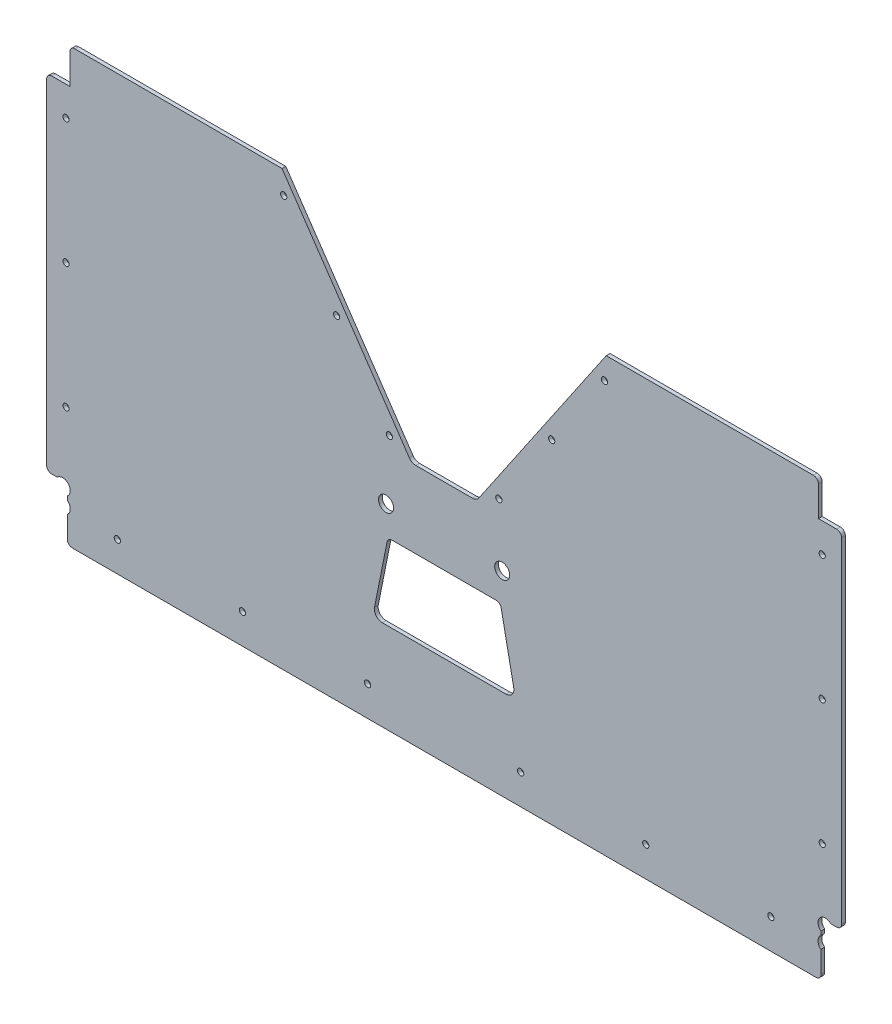
from build123d import *

# Parameters (mm, degrees)
SKETCH_1_R          = 6
EXTRUDE_1_DEPTH     = 3
SKETCH_2_R          = 2.5
SKETCH_2_W          = 12
SKETCH_2_H          = 28
SKETCH_2_W_2        = 10
CUT_EXTRUDE_1_DEPTH = 725.098439741
SKETCH_3_W          = 6.5
SKETCH_3_H          = 275.47
EXTRUDE_2_DEPTH     = 3
SKETCH_4_W          = 602.3
SKETCH_4_H          = 15
EXTRUDE_3_DEPTH     = 3
FILLET_1_R          = 4


with BuildPart() as part:
    # 草图1 → 凸台-拉伸1 (new body)
    with BuildSketch(Plane.XY):
        with BuildLine():
            Line((64.592959067, -287.27493325), (-37.121356584, -436.580350718))
            ThreePointArc((-37.121356584, -436.580350718), (-39.401099826, -438.618784839), (-42.369287668, -439.355197667))
            Line((-42.369287668, -439.355197667), (-87.565404468, -439.355197667))
            ThreePointArc((-87.565404468, -439.355197667), (-90.533592309, -438.618784839), (-92.813335552, -436.580350718))
            Line((-92.813335552, -436.580350718), (-194.527651202, -287.27493325))
            Line((-194.527651202, -287.27493325), (-376.117346068, -287.27493325))
            Line((-376.117346068, -287.27493325), (-376.117346068, -612.39493325))
            ThreePointArc((-376.117346068, -612.39493325), (-374.257474128, -616.885061311), (-369.767346068, -618.74493325))
            Line((-369.767346068, -618.74493325), (239.832653932, -618.74493325))
            ThreePointArc((239.832653932, -618.74493325), (244.322781993, -616.885061311), (246.182653932, -612.39493325))
            Line((246.182653932, -612.39493325), (246.182653932, -287.27493325))
            Line((246.182653932, -287.27493325), (64.592959067, -287.27493325))
        make_face()
        with Locations((-111.371152168, -477.768197584)):
            Circle(SKETCH_1_R, mode=Mode.SUBTRACT)
        with Locations((-18.563539968, -477.768197584)):
            Circle(SKETCH_1_R, mode=Mode.SUBTRACT)
        with Locations((239.832653932, -607.63243325)):
            Circle(SKETCH_1_R, mode=Mode.SUBTRACT)
        with Locations((239.832653932, -594.93243325)):
            Circle(SKETCH_1_R, mode=Mode.SUBTRACT)
        with Locations(Location((-369.767346068, -607.63243325, 0), (0, 0, 180))):
            Circle(SKETCH_1_R, mode=Mode.SUBTRACT)
        with Locations(Location((-369.767346068, -594.93243325, 0), (0, 0, 180))):
            Circle(SKETCH_1_R, mode=Mode.SUBTRACT)
        with BuildLine():
            Line((-120.598278576, -553.999595792), (-117.888346515, -540.449935487))
            Line((-117.888346515, -540.449935487), (-113.593422095, -518.975313388))
            Line((-113.593422095, -518.975313388), (-109.909811627, -500.557261048))
            ThreePointArc((-109.909811627, -500.557261048), (-109.015545442, -498.354731753), (-107.373986867, -496.635390964))
            Line((-107.373986867, -496.635390964), (-68.658208598, -468.981263629))
            ThreePointArc((-68.658208598, -468.981263629), (-64.967346068, -467.798471171), (-61.276483538, -468.981263629))
            Line((-61.276483538, -468.981263629), (-22.560705269, -496.635390964))
            ThreePointArc((-22.560705269, -496.635390964), (-20.919146693, -498.354731753), (-20.024880508, -500.557261048))
            Line((-20.024880508, -500.557261048), (-16.34127004, -518.975313388))
            Line((-16.34127004, -518.975313388), (-12.04634562, -540.449935487))
            Line((-12.04634562, -540.449935487), (-9.336413559, -553.999595792))
            ThreePointArc((-9.336413559, -553.999595792), (-10.652378252, -559.270762801), (-15.56310085, -561.59493325))
            Line((-15.56310085, -561.59493325), (-114.371591285, -561.59493325))
            ThreePointArc((-114.371591285, -561.59493325), (-119.282313883, -559.270762801), (-120.598278576, -553.999595792))
        make_face(mode=Mode.SUBTRACT)
    extrude(amount=EXTRUDE_1_DEPTH)

    # 草图2 → 切除-拉伸1 (cut, through all)
    with BuildSketch(Plane.XY.offset(3)):
        with Locations((-193.155157013, -305.27493325)):
            Circle(SKETCH_2_R)
        with Locations((-108.702722738, -429.24180925)):
            Circle(SKETCH_2_R)
        with Locations((-150.928939875, -367.25837125)):
            Circle(SKETCH_2_R)
        with Locations((-326.117346068, -609.74493325)):
            Circle(SKETCH_2_R)
        with Locations((-367.117346068, -338.74493325)):
            Circle(SKETCH_2_R)
        with Locations((-367.117346068, -538.74493325)):
            Circle(SKETCH_2_R)
        with Locations((-367.117346068, -438.74493325)):
            Circle(SKETCH_2_R)
        with Locations((-126.117346068, -609.74493325)):
            Circle(SKETCH_2_R)
        with Locations((-226.117346068, -609.74493325)):
            Circle(SKETCH_2_R)
        with Locations(Location((-21.231969397, -429.24180925, 0), (0, 0, 180))):
            Circle(SKETCH_2_R)
        with Locations(Location((20.99424774, -367.25837125, 0), (0, 0, 180))):
            Circle(SKETCH_2_R)
        with Locations(Location((63.220464877, -305.27493325, 0), (0, 0, 180))):
            Circle(SKETCH_2_R)
        with Locations(Location((237.182653932, -338.74493325, 0), (0, 0, 180))):
            Circle(SKETCH_2_R)
        with Locations(Location((237.182653932, -438.74493325, 0), (0, 0, 180))):
            Circle(SKETCH_2_R)
        with Locations(Location((237.182653932, -538.74493325, 0), (0, 0, 180))):
            Circle(SKETCH_2_R)
        with Locations(Location((196.182653932, -609.74493325, 0), (0, 0, 180))):
            Circle(SKETCH_2_R)
        with Locations(Location((96.182653932, -609.74493325, 0), (0, 0, 180))):
            Circle(SKETCH_2_R)
        with Locations(Location((-3.817346068, -609.74493325, 0), (0, 0, 180))):
            Circle(SKETCH_2_R)
        with Locations((240.182653932, -301.27493325)):
            Rectangle(SKETCH_2_W, SKETCH_2_H)
        with Locations((-370.117346068, -301.27493325)):
            Rectangle(SKETCH_2_W, SKETCH_2_H)
        with Locations((-371.117346068, -604.74493325)):
            Rectangle(SKETCH_2_W_2, SKETCH_2_H)
        with Locations((241.182653932, -604.74493325)):
            Rectangle(SKETCH_2_W_2, SKETCH_2_H)
    extrude(amount=-CUT_EXTRUDE_1_DEPTH, mode=Mode.SUBTRACT)

    # 草图3 → 凸台-拉伸2 (add)
    with BuildSketch(Plane.XY.offset(3)):
        Polygon((-109.909811627, -500.557261048), (-20.024880508, -500.557261048), (-20.024880508, -490.663105306), (-58.077135265, -460.679906373), (-109.015545442, -490.663105306), align=None)
        with Locations((-379.367346068, -453.00993325)):
            Rectangle(SKETCH_3_W, SKETCH_3_H)
        with Locations((249.432653932, -453.00993325)):
            Rectangle(SKETCH_3_W, SKETCH_3_H)
    extrude(amount=-EXTRUDE_2_DEPTH)

    # 草图4 → 凸台-拉伸3 (add)
    with BuildSketch(Plane.XY.offset(3)):
        with Locations((-64.967346068, -626.24493325)):
            Rectangle(SKETCH_4_W, SKETCH_4_H)
    extrude(amount=-EXTRUDE_3_DEPTH)

    # 圆角1
    fillet_1_edges = [part.edges().sort_by_distance(p)[0] for p in [
        (234.182653932, -287.27493325, 1.5),
        (-364.117346068, -287.27493325, 1.5),
        (252.682653932, -315.27493325, 1.5),
        (252.682653932, -590.74493325, 1.5),
        (-382.617346068, -590.74493325, 1.5),
        (-382.617346068, -315.27493325, 1.5),
        (-366.117346068, -633.74493325, 1.5),
        (236.182653932, -633.74493325, 1.5),
        (-20.024880508, -500.557261048, 1.5),
        (-109.909811627, -500.557261048, 1.5),
    ]]
    fillet(fillet_1_edges, radius=FILLET_1_R)


solid = part.part
